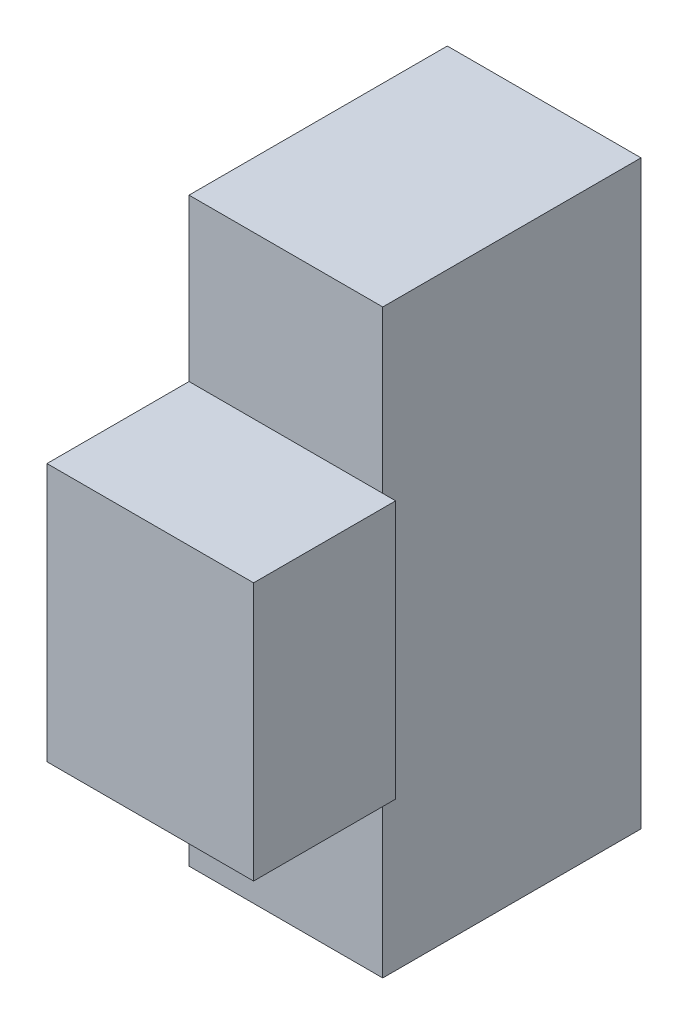
from build123d import *

# Parameters (mm, degrees)
SKETCH_1_W          = 20
SKETCH_1_H          = 45
EXTRUDE_1_DEPTH     = 15
SKETCH_4_W          = 11
SKETCH_4_H          = 20
EXTRUDE_2_DEPTH     = 16
CUT_EXTRUDE_1_DEPTH = 11.4


with BuildPart() as part:
    # 草图1 → 凸台-拉伸1 (new body)
    with BuildSketch(Plane(origin=(0, 0, 0), x_dir=(0, 0, -1), z_dir=(1, 0, 0))):
        with Locations((-10, 0)):
            Rectangle(SKETCH_1_W, SKETCH_1_H)
    extrude(amount=EXTRUDE_1_DEPTH)

    # 草图4 → 凸台-拉伸2 (add)
    with BuildSketch(Plane(origin=(0, 0, 0), x_dir=(0, 0, -1), z_dir=(1, 0, 0))):
        with Locations((-25.5, 0)):
            Rectangle(SKETCH_4_W, SKETCH_4_H)
    extrude(amount=EXTRUDE_2_DEPTH)

    # 草图2 → 切除-拉伸1 (cut)
    with BuildSketch(Plane(origin=(0, 0, 0), x_dir=(0, 0, -1), z_dir=(1, 0, 0))):
        with BuildLine():
            Line((-17.9, 13.1), (-17.9, -13.1))
            ThreePointArc((-17.9, -13.1), (-10, -21), (-2.1, -13.1))
            Line((-2.1, -13.1), (-2.1, 13.1))
            ThreePointArc((-2.1, 13.1), (-10, 21), (-17.9, 13.1))
        make_face()
    extrude(amount=CUT_EXTRUDE_1_DEPTH, mode=Mode.SUBTRACT)


solid = part.part
